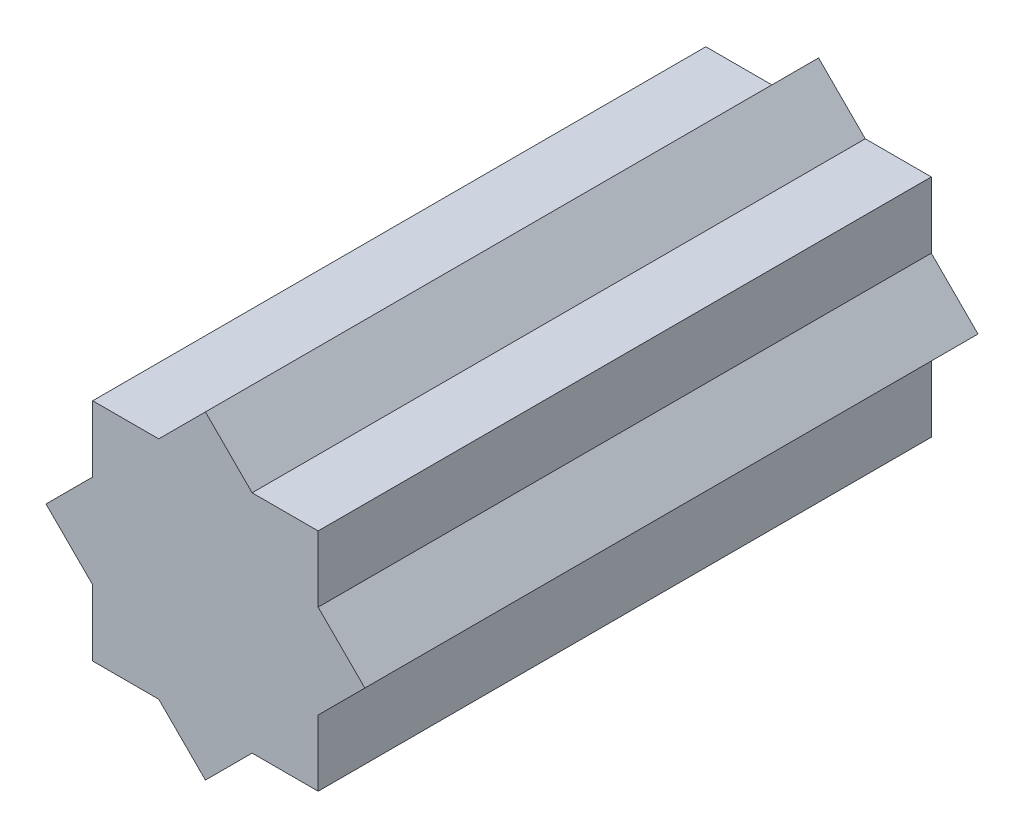
from build123d import *

# Parameters (mm, degrees)
BOSS_EXTRUDE1_DEPTH      = 7.5
BOSS_EXTRUDE1_DEPTH_BACK = 7.5


with BuildPart() as part:
    # Sketch1 → Boss-Extrude1 (new, two sides: drawn at the far end of the back side and taken through both)
    with BuildSketch(Plane.XY.offset(-BOSS_EXTRUDE1_DEPTH_BACK)):
        Polygon((0, 3.9), (1.142283553, 2.757716447), (2.757716447, 2.757716447), (2.757716447, 1.142283553), (3.9, 0), (2.757716447, -1.142283553), (2.757716447, -2.757716447), (1.142283553, -2.757716447), (0, -3.9), (-1.142283553, -2.757716447), (-2.757716447, -2.757716447), (-2.757716447, -1.142283553), (-3.9, 0), (-2.757716447, 1.142283553), (-2.757716447, 2.757716447), (-1.142283553, 2.757716447), align=None)
    extrude(amount=BOSS_EXTRUDE1_DEPTH + BOSS_EXTRUDE1_DEPTH_BACK)


solid = part.part
